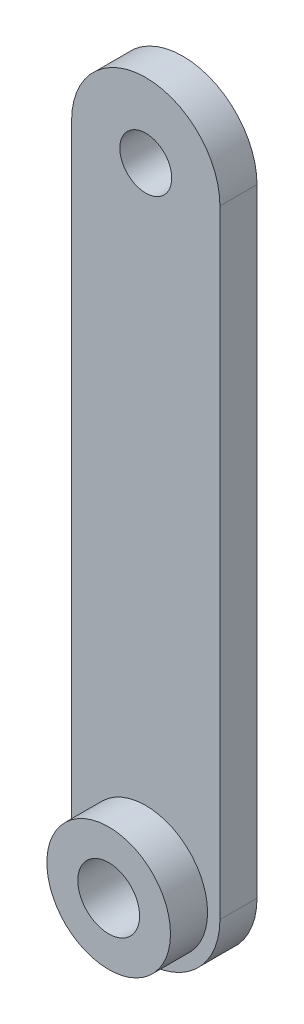
from build123d import *

# Parameters (mm, degrees)
BOSS_EXTRUDE1_DEPTH = 1.5
SKETCH2_R           = 5
SKETCH2_R_2         = 2.5
BOSS_EXTRUDE2_DEPTH = 3
CUT_EXTRUDE1_REACH  = 58.4
SKETCH2_2_R         = 2.5
CUT_EXTRUDE2_REACH  = 58.4
SKETCH5_R           = 2.1


with BuildPart() as part:
    # Sketch1 → Boss-Extrude1 (new, symmetric)
    with BuildSketch(Plane.XY):
        with BuildLine():
            ThreePointArc((6, 50), (0, 56), (-6, 50))
            Line((-6, 50), (-6, 0))
            ThreePointArc((-6, 0), (0, -6), (6, 0))
            Line((6, 0), (6, 50))
        make_face()
    extrude(amount=BOSS_EXTRUDE1_DEPTH, both=True)

    # Sketch2 → Boss-Extrude2 (add)
    with BuildSketch(Plane.XY.offset(1.5)):
        Circle(SKETCH2_R)
        Circle(SKETCH2_R_2, mode=Mode.SUBTRACT)
    extrude(amount=BOSS_EXTRUDE2_DEPTH)

    # Sketch2<2> → Cut-Extrude1 (cut, up to next)
    with BuildSketch(Plane.XY.offset(1.5), mode=Mode.PRIVATE) as cut_extrude1_sk1:
        Circle(SKETCH2_2_R)
    cut_extrude1_tool1 = extrude(cut_extrude1_sk1.sketch, amount=-CUT_EXTRUDE1_REACH, mode=Mode.PRIVATE) & part.part
    add(cut_extrude1_tool1.solids().sort_by_distance((0, 0, 1.5))[0], mode=Mode.SUBTRACT)

    # Sketch5 → Cut-Extrude2 (cut, up to next)
    with BuildSketch(Plane.XY.offset(1.5), mode=Mode.PRIVATE) as cut_extrude2_sk1:
        with Locations((0, 50)):
            Circle(SKETCH5_R)
    cut_extrude2_tool1 = extrude(cut_extrude2_sk1.sketch, amount=-CUT_EXTRUDE2_REACH, mode=Mode.PRIVATE) & part.part
    add(cut_extrude2_tool1.solids().sort_by_distance((0, 50, 1.5))[0], mode=Mode.SUBTRACT)


solid = part.part
